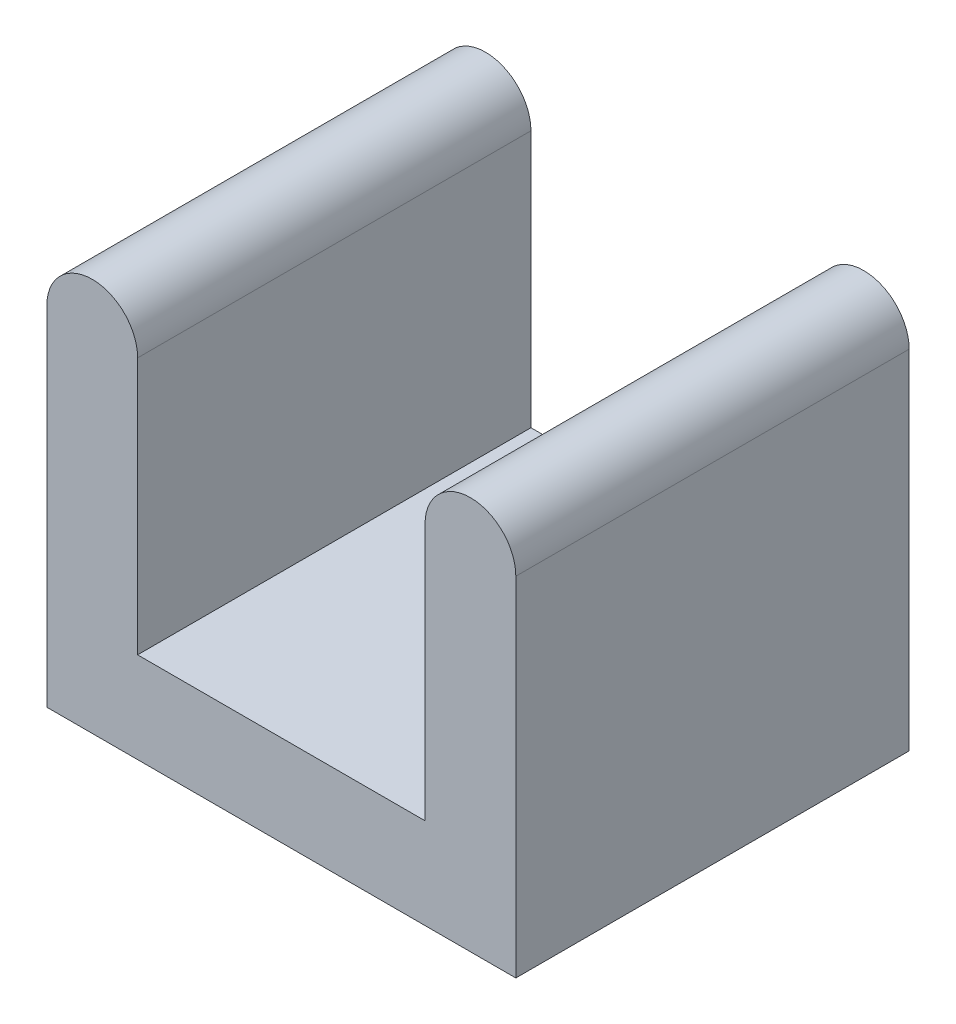
from build123d import *

# Parameters (mm, degrees)
BOSS_EXTRUDE5_DEPTH      = 25
BOSS_EXTRUDE5_DEPTH_BACK = 1


with BuildPart() as part:
    # Sketch2 → Boss-Extrude5 (new, two sides: drawn at the far end of the back side and taken through both)
    with BuildSketch(Plane.XY.offset(-BOSS_EXTRUDE5_DEPTH_BACK)):
        with BuildLine():
            Line((-32.044117647, 29.926470588), (-32.044117647, 6.926470588))
            Line((-32.044117647, 6.926470588), (-1.044117647, 6.926470588))
            Line((-1.044117647, 6.926470588), (-1.044117647, 29.926470588))
            ThreePointArc((-1.044117647, 29.926470588), (-4.044117647, 32.926470588), (-7.044117647, 29.926470588))
            Line((-7.044117647, 29.926470588), (-7.044117647, 12.926470588))
            Line((-7.044117647, 12.926470588), (-26.044117647, 12.926470588))
            Line((-26.044117647, 12.926470588), (-26.044117647, 29.926470588))
            ThreePointArc((-26.044117647, 29.926470588), (-29.044117647, 32.926470588), (-32.044117647, 29.926470588))
        make_face()
    extrude(amount=BOSS_EXTRUDE5_DEPTH + BOSS_EXTRUDE5_DEPTH_BACK)


solid = part.part
